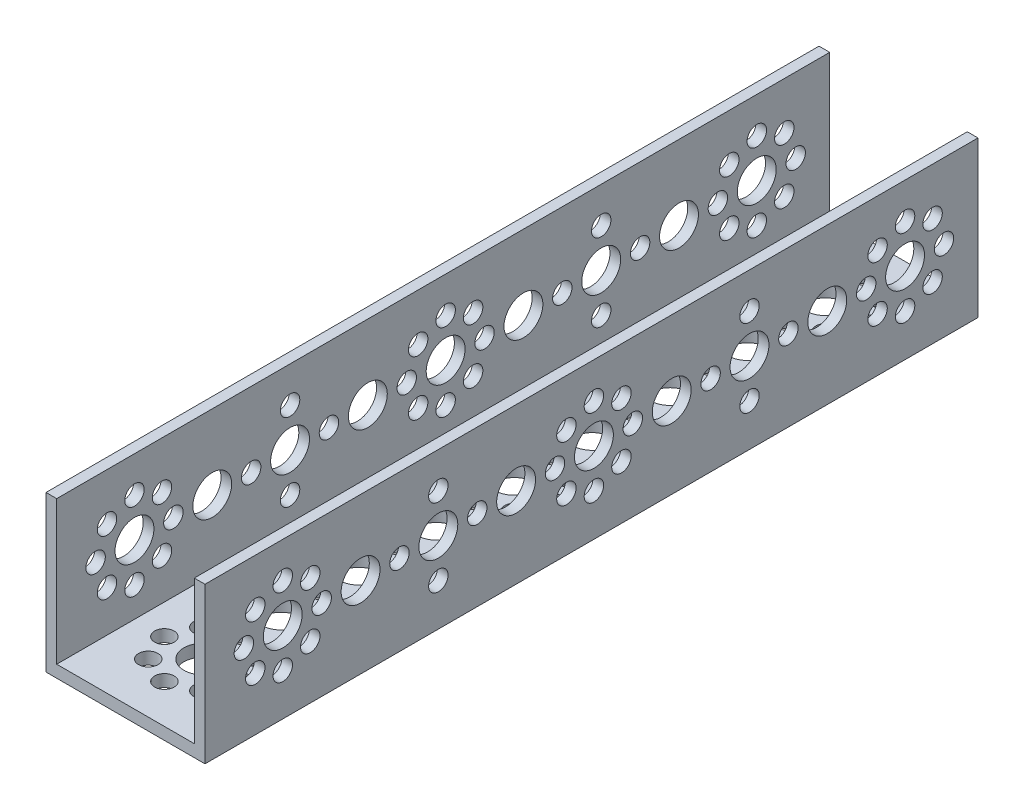
from build123d import *

# Parameters (mm, degrees)
BOSS_EXTRU_1_DEPTH                    = 159
ESQUISSE2_R                           = 4
ENL_V_MAT_EXTRU_1_DEPTH               = 166.451775451
R_P_TITION_LIN_AIRE1_COUNT            = 9
R_P_TITION_LIN_AIRE1_PITCH            = 16
ESQUISSE3_R                           = 2
ENL_V_MAT_EXTRU_2_DEPTH               = 166.451775451
R_P_TITION_CIRCULAIRE1_COUNT          = 4
R_P_TITION_CIRCULAIRE2_COUNT          = 8
R_P_TITION_LIN_AIRE2_COUNT            = 10
R_P_TITION_LIN_AIRE2_PITCH            = 16
R_P_TITION_LIN_AIRE2_COPY_1_SKETCH_R  = 2
R_P_TITION_LIN_AIRE2_COPY_1_DEPTH     = 166.451775451
R_P_TITION_LIN_AIRE2_COPY_2_SKETCH_R  = 2
R_P_TITION_LIN_AIRE2_COPY_2_DEPTH     = 166.451775451
R_P_TITION_LIN_AIRE2_COPY_3_SKETCH_R  = 2
R_P_TITION_LIN_AIRE2_COPY_3_DEPTH     = 166.451775451
R_P_TITION_LIN_AIRE2_COPY_4_SKETCH_R  = 2
R_P_TITION_LIN_AIRE2_COPY_4_DEPTH     = 166.451775451
R_P_TITION_LIN_AIRE2_COPY_5_SKETCH_R  = 2
R_P_TITION_LIN_AIRE2_COPY_5_DEPTH     = 166.451775451
R_P_TITION_LIN_AIRE2_COPY_6_SKETCH_R  = 2
R_P_TITION_LIN_AIRE2_COPY_6_DEPTH     = 166.451775451
R_P_TITION_LIN_AIRE2_COPY_7_SKETCH_R  = 2
R_P_TITION_LIN_AIRE2_COPY_7_DEPTH     = 166.451775451
R_P_TITION_LIN_AIRE2_COPY_8_SKETCH_R  = 2
R_P_TITION_LIN_AIRE2_COPY_8_DEPTH     = 166.451775451
R_P_TITION_LIN_AIRE2_COPY_9_SKETCH_R  = 2
R_P_TITION_LIN_AIRE2_COPY_9_DEPTH     = 166.451775451
R_P_TITION_LIN_AIRE2_COPY_10_SKETCH_R = 2
R_P_TITION_LIN_AIRE2_COPY_10_DEPTH    = 166.451775451
R_P_TITION_LIN_AIRE2_COPY_11_SKETCH_R = 2
R_P_TITION_LIN_AIRE2_COPY_11_DEPTH    = 166.451775451
R_P_TITION_LIN_AIRE2_COPY_12_SKETCH_R = 2
R_P_TITION_LIN_AIRE2_COPY_12_DEPTH    = 166.451775451
R_P_TITION_LIN_AIRE3_COPY_1_SKETCH_R  = 2
R_P_TITION_LIN_AIRE3_COPY_1_DEPTH     = 166.451775451
R_P_TITION_LIN_AIRE3_COPY_2_SKETCH_R  = 2
R_P_TITION_LIN_AIRE3_COPY_2_DEPTH     = 166.451775451
R_P_TITION_LIN_AIRE3_COPY_3_SKETCH_R  = 2
R_P_TITION_LIN_AIRE3_COPY_3_DEPTH     = 166.451775451
R_P_TITION_LIN_AIRE3_COPY_4_SKETCH_R  = 2
R_P_TITION_LIN_AIRE3_COPY_4_DEPTH     = 166.451775451
R_P_TITION_LIN_AIRE3_COPY_5_SKETCH_R  = 2
R_P_TITION_LIN_AIRE3_COPY_5_DEPTH     = 166.451775451
R_P_TITION_LIN_AIRE3_COPY_6_SKETCH_R  = 2
R_P_TITION_LIN_AIRE3_COPY_6_DEPTH     = 166.451775451
R_P_TITION_LIN_AIRE3_COPY_7_SKETCH_R  = 2
R_P_TITION_LIN_AIRE3_COPY_7_DEPTH     = 166.451775451
R_P_TITION_LIN_AIRE3_COPY_8_SKETCH_R  = 2
R_P_TITION_LIN_AIRE3_COPY_8_DEPTH     = 166.451775451
R_P_TITION_LIN_AIRE3_COPY_9_SKETCH_R  = 2
R_P_TITION_LIN_AIRE3_COPY_9_DEPTH     = 166.451775451
R_P_TITION_LIN_AIRE3_COPY_10_SKETCH_R = 2
R_P_TITION_LIN_AIRE3_COPY_10_DEPTH    = 166.451775451
SYM_TRIE2_COPY_1_SKETCH_R             = 4
SYM_TRIE2_COPY_1_DEPTH                = 166.451775451
SYM_TRIE2_COPY_2_SKETCH_R             = 4
SYM_TRIE2_COPY_2_DEPTH                = 166.451775451
SYM_TRIE2_COPY_3_SKETCH_R             = 4
SYM_TRIE2_COPY_3_DEPTH                = 166.451775451
SYM_TRIE2_COPY_4_SKETCH_R             = 4
SYM_TRIE2_COPY_4_DEPTH                = 166.451775451
SYM_TRIE2_COPY_5_SKETCH_R             = 4
SYM_TRIE2_COPY_5_DEPTH                = 166.451775451
SYM_TRIE2_COPY_6_SKETCH_R             = 4
SYM_TRIE2_COPY_6_DEPTH                = 166.451775451
SYM_TRIE2_COPY_7_SKETCH_R             = 4
SYM_TRIE2_COPY_7_DEPTH                = 166.451775451
SYM_TRIE2_COPY_8_SKETCH_R             = 4
SYM_TRIE2_COPY_8_DEPTH                = 166.451775451
SYM_TRIE2_COPY_9_SKETCH_R             = 2
SYM_TRIE2_COPY_9_DEPTH                = 166.451775451
SYM_TRIE2_COPY_10_SKETCH_R            = 2
SYM_TRIE2_COPY_10_DEPTH               = 166.451775451
SYM_TRIE2_COPY_11_SKETCH_R            = 2
SYM_TRIE2_COPY_11_DEPTH               = 166.451775451
SYM_TRIE2_COPY_12_SKETCH_R            = 2
SYM_TRIE2_COPY_12_DEPTH               = 166.451775451
SYM_TRIE2_COPY_13_SKETCH_R            = 2
SYM_TRIE2_COPY_13_DEPTH               = 166.451775451
SYM_TRIE2_COPY_14_SKETCH_R            = 2
SYM_TRIE2_COPY_14_DEPTH               = 166.451775451
SYM_TRIE2_COPY_15_SKETCH_R            = 2
SYM_TRIE2_COPY_15_DEPTH               = 166.451775451
SYM_TRIE2_COPY_16_SKETCH_R            = 2
SYM_TRIE2_COPY_16_DEPTH               = 166.451775451
SYM_TRIE2_COPY_17_SKETCH_R            = 2
SYM_TRIE2_COPY_17_DEPTH               = 166.451775451
SYM_TRIE2_COPY_18_SKETCH_R            = 2
SYM_TRIE2_COPY_18_DEPTH               = 166.451775451
SYM_TRIE2_COPY_19_SKETCH_R            = 2
SYM_TRIE2_COPY_19_DEPTH               = 166.451775451
SYM_TRIE2_COPY_20_SKETCH_R            = 2
SYM_TRIE2_COPY_20_DEPTH               = 166.451775451
SYM_TRIE2_COPY_21_SKETCH_R            = 2
SYM_TRIE2_COPY_21_DEPTH               = 166.451775451
SYM_TRIE2_COPY_22_SKETCH_R            = 2
SYM_TRIE2_COPY_22_DEPTH               = 166.451775451
SYM_TRIE2_COPY_23_SKETCH_R            = 2
SYM_TRIE2_COPY_23_DEPTH               = 166.451775451
SYM_TRIE2_COPY_24_SKETCH_R            = 2
SYM_TRIE2_COPY_24_DEPTH               = 166.451775451
SYM_TRIE2_COPY_25_SKETCH_R            = 2
SYM_TRIE2_COPY_25_DEPTH               = 166.451775451
SYM_TRIE2_COPY_26_SKETCH_R            = 2
SYM_TRIE2_COPY_26_DEPTH               = 166.451775451
SYM_TRIE2_COPY_27_SKETCH_R            = 2
SYM_TRIE2_COPY_27_DEPTH               = 166.451775451
SYM_TRIE2_COPY_28_SKETCH_R            = 2
SYM_TRIE2_COPY_28_DEPTH               = 166.451775451
SYM_TRIE2_COPY_29_SKETCH_R            = 2
SYM_TRIE2_COPY_29_DEPTH               = 166.451775451
SYM_TRIE2_COPY_30_SKETCH_R            = 2
SYM_TRIE2_COPY_30_DEPTH               = 166.451775451
SYM_TRIE2_COPY_31_SKETCH_R            = 2
SYM_TRIE2_COPY_31_DEPTH               = 166.451775451
SYM_TRIE2_COPY_32_SKETCH_R            = 2
SYM_TRIE2_COPY_32_DEPTH               = 166.451775451
SYM_TRIE2_COPY_33_SKETCH_R            = 2
SYM_TRIE2_COPY_33_DEPTH               = 166.451775451
SYM_TRIE2_COPY_34_SKETCH_R            = 2
SYM_TRIE2_COPY_34_DEPTH               = 166.451775451
SYM_TRIE2_COPY_35_SKETCH_R            = 2
SYM_TRIE2_COPY_35_DEPTH               = 166.451775451
SYM_TRIE2_COPY_36_SKETCH_R            = 2
SYM_TRIE2_COPY_36_DEPTH               = 166.451775451
SYM_TRIE2_COPY_37_SKETCH_R            = 2
SYM_TRIE2_COPY_37_DEPTH               = 166.451775451
SYM_TRIE2_COPY_38_SKETCH_R            = 2
SYM_TRIE2_COPY_38_DEPTH               = 166.451775451
SYM_TRIE2_COPY_39_SKETCH_R            = 2
SYM_TRIE2_COPY_39_DEPTH               = 166.451775451
SYM_TRIE2_COPY_40_SKETCH_R            = 2
SYM_TRIE2_COPY_40_DEPTH               = 166.451775451
SYM_TRIE2_COPY_41_SKETCH_R            = 2
SYM_TRIE2_COPY_41_DEPTH               = 166.451775451


with BuildPart() as part:
    # Esquisse1 → Boss.-Extru.1 (new body)
    with BuildSketch(Plane.XY):
        Polygon((0, 0), (0, 32), (2.2, 32), (2.2, 2.5), (30.5, 2.5), (30.5, 32), (32.7, 32), (32.7, 0), align=None)
    extrude(amount=BOSS_EXTRU_1_DEPTH)

    # Esquisse2 → Enlèv. mat.-Extru.1 (cut, symmetric)
    with BuildSketch(Plane(origin=(0, 0, 0), x_dir=(-1, 0, 0), z_dir=(0, -1, 0))):
        with Locations(Location((-16.35, -143, 0), (0, 0, 180))):
            Circle(ESQUISSE2_R)
    enl_v_mat_extru_1 = extrude(amount=ENL_V_MAT_EXTRU_1_DEPTH, both=True, mode=Mode.SUBTRACT)

    # Répétition linéaire1: Enlèv. mat.-Extru.1 ×9
    with Locations(*[(0, 0, -i * R_P_TITION_LIN_AIRE1_PITCH) for i in range(1, R_P_TITION_LIN_AIRE1_COUNT)]):
        add(enl_v_mat_extru_1, mode=Mode.SUBTRACT)

    # Esquisse3 → Enlèv. mat.-Extru.2 (cut, symmetric)
    with BuildSketch(Plane.XZ):
        with Locations((24.35, 143)):
            Circle(ESQUISSE3_R)
    enl_v_mat_extru_2 = extrude(amount=ENL_V_MAT_EXTRU_2_DEPTH, both=True, mode=Mode.SUBTRACT)

    # Répétition circulaire1: Enlèv. mat.-Extru.2 ×4 about axis
    r_p_tition_circulaire1_axis = Axis((16.35, 0, 143), (0, 1, 0))
    for i in range(1, R_P_TITION_CIRCULAIRE1_COUNT):
        add(enl_v_mat_extru_2.rotate(r_p_tition_circulaire1_axis, i * 360 / R_P_TITION_CIRCULAIRE1_COUNT), mode=Mode.SUBTRACT)

    # Répétition circulaire2: Enlèv. mat.-Extru.2 ×8 about axis, 3 skipped
    r_p_tition_circulaire2_axis = Axis((16.35, 0, 143), (0, 1, 0))
    add([enl_v_mat_extru_2.rotate(r_p_tition_circulaire2_axis, i * 360 / R_P_TITION_CIRCULAIRE2_COUNT) for i in range(1, R_P_TITION_CIRCULAIRE2_COUNT) if i not in (2, 4, 6)], mode=Mode.SUBTRACT)

    # Répétition linéaire2: Enlèv. mat.-Extru.2 ×10, 5 skipped
    with Locations(*[(0, 0, -i * R_P_TITION_LIN_AIRE2_PITCH) for i in range(1, R_P_TITION_LIN_AIRE2_COUNT) if i not in (1, 3, 5, 7, 9)]):
        add(enl_v_mat_extru_2, mode=Mode.SUBTRACT)

    # Répétition linéaire2 copy 1 sketch → Répétition linéaire2 copy 1 (cut, symmetric)
    with BuildSketch(Plane(origin=(-126.65, 0, 127.35), x_dir=(0, 0, -1), z_dir=(0, -1, 0))):
        with Locations((24.35, 143)):
            Circle(R_P_TITION_LIN_AIRE2_COPY_1_SKETCH_R)
    extrude(amount=R_P_TITION_LIN_AIRE2_COPY_1_DEPTH, both=True, mode=Mode.SUBTRACT)

    # Répétition linéaire2 copy 2 sketch → Répétition linéaire2 copy 2 (cut, symmetric)
    with BuildSketch(Plane(origin=(-126.65, 0, 95.35), x_dir=(0, 0, -1), z_dir=(0, -1, 0))):
        with Locations((24.35, 143)):
            Circle(R_P_TITION_LIN_AIRE2_COPY_2_SKETCH_R)
    extrude(amount=R_P_TITION_LIN_AIRE2_COPY_2_DEPTH, both=True, mode=Mode.SUBTRACT)

    # Répétition linéaire2 copy 3 sketch → Répétition linéaire2 copy 3 (cut, symmetric)
    with BuildSketch(Plane(origin=(-126.65, 0, 63.35), x_dir=(0, 0, -1), z_dir=(0, -1, 0))):
        with Locations((24.35, 143)):
            Circle(R_P_TITION_LIN_AIRE2_COPY_3_SKETCH_R)
    extrude(amount=R_P_TITION_LIN_AIRE2_COPY_3_DEPTH, both=True, mode=Mode.SUBTRACT)

    # Répétition linéaire2 copy 4 sketch → Répétition linéaire2 copy 4 (cut, symmetric)
    with BuildSketch(Plane(origin=(-126.65, 0, 31.35), x_dir=(0, 0, -1), z_dir=(0, -1, 0))):
        with Locations((24.35, 143)):
            Circle(R_P_TITION_LIN_AIRE2_COPY_4_SKETCH_R)
    extrude(amount=R_P_TITION_LIN_AIRE2_COPY_4_DEPTH, both=True, mode=Mode.SUBTRACT)

    # Répétition linéaire2 copy 5 sketch → Répétition linéaire2 copy 5 (cut, symmetric)
    with BuildSketch(Plane(origin=(32.7, 0, 254), x_dir=(-1, 0, 0), z_dir=(0, -1, 0))):
        with Locations((24.35, 143)):
            Circle(R_P_TITION_LIN_AIRE2_COPY_5_SKETCH_R)
    extrude(amount=R_P_TITION_LIN_AIRE2_COPY_5_DEPTH, both=True, mode=Mode.SUBTRACT)

    # Répétition linéaire2 copy 6 sketch → Répétition linéaire2 copy 6 (cut, symmetric)
    with BuildSketch(Plane(origin=(32.7, 0, 222), x_dir=(-1, 0, 0), z_dir=(0, -1, 0))):
        with Locations((24.35, 143)):
            Circle(R_P_TITION_LIN_AIRE2_COPY_6_SKETCH_R)
    extrude(amount=R_P_TITION_LIN_AIRE2_COPY_6_DEPTH, both=True, mode=Mode.SUBTRACT)

    # Répétition linéaire2 copy 7 sketch → Répétition linéaire2 copy 7 (cut, symmetric)
    with BuildSketch(Plane(origin=(32.7, 0, 190), x_dir=(-1, 0, 0), z_dir=(0, -1, 0))):
        with Locations((24.35, 143)):
            Circle(R_P_TITION_LIN_AIRE2_COPY_7_SKETCH_R)
    extrude(amount=R_P_TITION_LIN_AIRE2_COPY_7_DEPTH, both=True, mode=Mode.SUBTRACT)

    # Répétition linéaire2 copy 8 sketch → Répétition linéaire2 copy 8 (cut, symmetric)
    with BuildSketch(Plane(origin=(32.7, 0, 158), x_dir=(-1, 0, 0), z_dir=(0, -1, 0))):
        with Locations((24.35, 143)):
            Circle(R_P_TITION_LIN_AIRE2_COPY_8_SKETCH_R)
    extrude(amount=R_P_TITION_LIN_AIRE2_COPY_8_DEPTH, both=True, mode=Mode.SUBTRACT)

    # Répétition linéaire2 copy 9 sketch → Répétition linéaire2 copy 9 (cut, symmetric)
    with BuildSketch(Plane(origin=(159.35, 0, 94.65), x_dir=(0, 0, 1), z_dir=(0, -1, 0))):
        with Locations((24.35, 143)):
            Circle(R_P_TITION_LIN_AIRE2_COPY_9_SKETCH_R)
    extrude(amount=R_P_TITION_LIN_AIRE2_COPY_9_DEPTH, both=True, mode=Mode.SUBTRACT)

    # Répétition linéaire2 copy 10 sketch → Répétition linéaire2 copy 10 (cut, symmetric)
    with BuildSketch(Plane(origin=(159.35, 0, 62.65), x_dir=(0, 0, 1), z_dir=(0, -1, 0))):
        with Locations((24.35, 143)):
            Circle(R_P_TITION_LIN_AIRE2_COPY_10_SKETCH_R)
    extrude(amount=R_P_TITION_LIN_AIRE2_COPY_10_DEPTH, both=True, mode=Mode.SUBTRACT)

    # Répétition linéaire2 copy 11 sketch → Répétition linéaire2 copy 11 (cut, symmetric)
    with BuildSketch(Plane(origin=(159.35, 0, 30.65), x_dir=(0, 0, 1), z_dir=(0, -1, 0))):
        with Locations((24.35, 143)):
            Circle(R_P_TITION_LIN_AIRE2_COPY_11_SKETCH_R)
    extrude(amount=R_P_TITION_LIN_AIRE2_COPY_11_DEPTH, both=True, mode=Mode.SUBTRACT)

    # Répétition linéaire2 copy 12 sketch → Répétition linéaire2 copy 12 (cut, symmetric)
    with BuildSketch(Plane(origin=(159.35, 0, -1.35), x_dir=(0, 0, 1), z_dir=(0, -1, 0))):
        with Locations((24.35, 143)):
            Circle(R_P_TITION_LIN_AIRE2_COPY_12_SKETCH_R)
    extrude(amount=R_P_TITION_LIN_AIRE2_COPY_12_DEPTH, both=True, mode=Mode.SUBTRACT)

    # Répétition linéaire3 copy 1 sketch → Répétition linéaire3 copy 1 (cut, symmetric)
    with BuildSketch(Plane(origin=(-96.327465582, 0, -10.555073837), x_dir=(0.7071067811865476, 0, -0.7071067811865475), z_dir=(0, -1, 0))):
        with Locations((24.35, 143)):
            Circle(R_P_TITION_LIN_AIRE3_COPY_1_SKETCH_R)
    extrude(amount=R_P_TITION_LIN_AIRE3_COPY_1_DEPTH, both=True, mode=Mode.SUBTRACT)

    # Répétition linéaire3 copy 2 sketch → Répétition linéaire3 copy 2 (cut, symmetric)
    with BuildSketch(Plane(origin=(-96.327465582, 0, -74.555073837), x_dir=(0.7071067811865476, 0, -0.7071067811865475), z_dir=(0, -1, 0))):
        with Locations((24.35, 143)):
            Circle(R_P_TITION_LIN_AIRE3_COPY_2_SKETCH_R)
    extrude(amount=R_P_TITION_LIN_AIRE3_COPY_2_DEPTH, both=True, mode=Mode.SUBTRACT)

    # Répétition linéaire3 copy 3 sketch → Répétition linéaire3 copy 3 (cut, symmetric)
    with BuildSketch(Plane(origin=(-73.205073837, 0, 191.677465582), x_dir=(-0.7071067811865475, 0, -0.7071067811865476), z_dir=(0, -1, 0))):
        with Locations((24.35, 143)):
            Circle(R_P_TITION_LIN_AIRE3_COPY_3_SKETCH_R)
    extrude(amount=R_P_TITION_LIN_AIRE3_COPY_3_DEPTH, both=True, mode=Mode.SUBTRACT)

    # Répétition linéaire3 copy 4 sketch → Répétition linéaire3 copy 4 (cut, symmetric)
    with BuildSketch(Plane(origin=(-73.205073837, 0, 127.677465582), x_dir=(-0.7071067811865475, 0, -0.7071067811865476), z_dir=(0, -1, 0))):
        with Locations((24.35, 143)):
            Circle(R_P_TITION_LIN_AIRE3_COPY_4_SKETCH_R)
    extrude(amount=R_P_TITION_LIN_AIRE3_COPY_4_DEPTH, both=True, mode=Mode.SUBTRACT)

    # Répétition linéaire3 copy 5 sketch → Répétition linéaire3 copy 5 (cut, symmetric)
    with BuildSketch(Plane(origin=(129.027465582, 0, 168.555073837), x_dir=(-0.7071067811865477, 0, 0.7071067811865475), z_dir=(0, -1, 0))):
        with Locations((24.35, 143)):
            Circle(R_P_TITION_LIN_AIRE3_COPY_5_SKETCH_R)
    extrude(amount=R_P_TITION_LIN_AIRE3_COPY_5_DEPTH, both=True, mode=Mode.SUBTRACT)

    # Répétition linéaire3 copy 6 sketch → Répétition linéaire3 copy 6 (cut, symmetric)
    with BuildSketch(Plane(origin=(129.027465582, 0, 104.555073837), x_dir=(-0.7071067811865477, 0, 0.7071067811865475), z_dir=(0, -1, 0))):
        with Locations((24.35, 143)):
            Circle(R_P_TITION_LIN_AIRE3_COPY_6_SKETCH_R)
    extrude(amount=R_P_TITION_LIN_AIRE3_COPY_6_DEPTH, both=True, mode=Mode.SUBTRACT)

    # Répétition linéaire3 copy 7 sketch → Répétition linéaire3 copy 7 (cut, symmetric)
    with BuildSketch(Plane(origin=(105.905073837, 0, -33.677465582), x_dir=(0.7071067811865474, 0, 0.7071067811865477), z_dir=(0, -1, 0))):
        with Locations((24.35, 143)):
            Circle(R_P_TITION_LIN_AIRE3_COPY_7_SKETCH_R)
    extrude(amount=R_P_TITION_LIN_AIRE3_COPY_7_DEPTH, both=True, mode=Mode.SUBTRACT)

    # Répétition linéaire3 copy 8 sketch → Répétition linéaire3 copy 8 (cut, symmetric)
    with BuildSketch(Plane(origin=(105.905073837, 0, -97.677465582), x_dir=(0.7071067811865474, 0, 0.7071067811865477), z_dir=(0, -1, 0))):
        with Locations((24.35, 143)):
            Circle(R_P_TITION_LIN_AIRE3_COPY_8_SKETCH_R)
    extrude(amount=R_P_TITION_LIN_AIRE3_COPY_8_DEPTH, both=True, mode=Mode.SUBTRACT)

    # Répétition linéaire3 copy 9 sketch → Répétition linéaire3 copy 9 (cut, symmetric)
    with BuildSketch(Plane(origin=(0, 0, -64), x_dir=(1, 0, 0), z_dir=(0, -1, 0))):
        with Locations((24.35, 143)):
            Circle(R_P_TITION_LIN_AIRE3_COPY_9_SKETCH_R)
    extrude(amount=R_P_TITION_LIN_AIRE3_COPY_9_DEPTH, both=True, mode=Mode.SUBTRACT)

    # Répétition linéaire3 copy 10 sketch → Répétition linéaire3 copy 10 (cut, symmetric)
    with BuildSketch(Plane(origin=(0, 0, -128), x_dir=(1, 0, 0), z_dir=(0, -1, 0))):
        with Locations((24.35, 143)):
            Circle(R_P_TITION_LIN_AIRE3_COPY_10_SKETCH_R)
    extrude(amount=R_P_TITION_LIN_AIRE3_COPY_10_DEPTH, both=True, mode=Mode.SUBTRACT)

    # Symétrie2: Enlèv. mat.-Extru.1, Enlèv. mat.-Extru.2 across plane
    add(enl_v_mat_extru_1.mirror(Plane(origin=(-0.15, 0.15, 0), x_dir=(0, 0, 1), z_dir=(0.7071067811865477, -0.7071067811865475, 0))), mode=Mode.SUBTRACT)
    add(enl_v_mat_extru_2.mirror(Plane(origin=(-0.15, 0.15, 0), x_dir=(0, 0, 1), z_dir=(0.7071067811865477, -0.7071067811865475, 0))), mode=Mode.SUBTRACT)

    # Symétrie2 copy 1 sketch → Symétrie2 copy 1 (cut, symmetric)
    with BuildSketch(Plane(origin=(-0.3, 0.3, -16), x_dir=(0, -1, 0), z_dir=(-1, 0, 0))):
        with Locations((-16.35, 143)):
            Circle(SYM_TRIE2_COPY_1_SKETCH_R)
    extrude(amount=SYM_TRIE2_COPY_1_DEPTH, both=True, mode=Mode.SUBTRACT)

    # Symétrie2 copy 2 sketch → Symétrie2 copy 2 (cut, symmetric)
    with BuildSketch(Plane(origin=(-0.3, 0.3, -32), x_dir=(0, -1, 0), z_dir=(-1, 0, 0))):
        with Locations((-16.35, 143)):
            Circle(SYM_TRIE2_COPY_2_SKETCH_R)
    extrude(amount=SYM_TRIE2_COPY_2_DEPTH, both=True, mode=Mode.SUBTRACT)

    # Symétrie2 copy 3 sketch → Symétrie2 copy 3 (cut, symmetric)
    with BuildSketch(Plane(origin=(-0.3, 0.3, -48), x_dir=(0, -1, 0), z_dir=(-1, 0, 0))):
        with Locations((-16.35, 143)):
            Circle(SYM_TRIE2_COPY_3_SKETCH_R)
    extrude(amount=SYM_TRIE2_COPY_3_DEPTH, both=True, mode=Mode.SUBTRACT)

    # Symétrie2 copy 4 sketch → Symétrie2 copy 4 (cut, symmetric)
    with BuildSketch(Plane(origin=(-0.3, 0.3, -64), x_dir=(0, -1, 0), z_dir=(-1, 0, 0))):
        with Locations((-16.35, 143)):
            Circle(SYM_TRIE2_COPY_4_SKETCH_R)
    extrude(amount=SYM_TRIE2_COPY_4_DEPTH, both=True, mode=Mode.SUBTRACT)

    # Symétrie2 copy 5 sketch → Symétrie2 copy 5 (cut, symmetric)
    with BuildSketch(Plane(origin=(-0.3, 0.3, -80), x_dir=(0, -1, 0), z_dir=(-1, 0, 0))):
        with Locations((-16.35, 143)):
            Circle(SYM_TRIE2_COPY_5_SKETCH_R)
    extrude(amount=SYM_TRIE2_COPY_5_DEPTH, both=True, mode=Mode.SUBTRACT)

    # Symétrie2 copy 6 sketch → Symétrie2 copy 6 (cut, symmetric)
    with BuildSketch(Plane(origin=(-0.3, 0.3, -96), x_dir=(0, -1, 0), z_dir=(-1, 0, 0))):
        with Locations((-16.35, 143)):
            Circle(SYM_TRIE2_COPY_6_SKETCH_R)
    extrude(amount=SYM_TRIE2_COPY_6_DEPTH, both=True, mode=Mode.SUBTRACT)

    # Symétrie2 copy 7 sketch → Symétrie2 copy 7 (cut, symmetric)
    with BuildSketch(Plane(origin=(-0.3, 0.3, -112), x_dir=(0, -1, 0), z_dir=(-1, 0, 0))):
        with Locations((-16.35, 143)):
            Circle(SYM_TRIE2_COPY_7_SKETCH_R)
    extrude(amount=SYM_TRIE2_COPY_7_DEPTH, both=True, mode=Mode.SUBTRACT)

    # Symétrie2 copy 8 sketch → Symétrie2 copy 8 (cut, symmetric)
    with BuildSketch(Plane(origin=(-0.3, 0.3, -128), x_dir=(0, -1, 0), z_dir=(-1, 0, 0))):
        with Locations((-16.35, 143)):
            Circle(SYM_TRIE2_COPY_8_SKETCH_R)
    extrude(amount=SYM_TRIE2_COPY_8_DEPTH, both=True, mode=Mode.SUBTRACT)

    # Symétrie2 copy 9 sketch → Symétrie2 copy 9 (cut, symmetric)
    with BuildSketch(Plane(origin=(-0.3, -126.35, 159.35), x_dir=(0, 0, -1), z_dir=(-1, 0, 0))):
        with Locations((24.35, -143)):
            Circle(SYM_TRIE2_COPY_9_SKETCH_R)
    extrude(amount=SYM_TRIE2_COPY_9_DEPTH, both=True, mode=Mode.SUBTRACT)

    # Symétrie2 copy 10 sketch → Symétrie2 copy 10 (cut, symmetric)
    with BuildSketch(Plane(origin=(-0.3, 33, 286), x_dir=(0, -1, 0), z_dir=(-1, 0, 0))):
        with Locations((24.35, -143)):
            Circle(SYM_TRIE2_COPY_10_SKETCH_R)
    extrude(amount=SYM_TRIE2_COPY_10_DEPTH, both=True, mode=Mode.SUBTRACT)

    # Symétrie2 copy 11 sketch → Symétrie2 copy 11 (cut, symmetric)
    with BuildSketch(Plane(origin=(-0.3, 159.65, 126.65), x_dir=(0, 0, 1), z_dir=(-1, 0, 0))):
        with Locations((24.35, -143)):
            Circle(SYM_TRIE2_COPY_11_SKETCH_R)
    extrude(amount=SYM_TRIE2_COPY_11_DEPTH, both=True, mode=Mode.SUBTRACT)

    # Symétrie2 copy 12 sketch → Symétrie2 copy 12 (cut, symmetric)
    with BuildSketch(Plane(origin=(-0.3, -96.027465582, 53.444926163), x_dir=(0, 0.7071067811865477, -0.7071067811865475), z_dir=(-1, 0, 0))):
        with Locations((24.35, -143)):
            Circle(SYM_TRIE2_COPY_12_SKETCH_R)
    extrude(amount=SYM_TRIE2_COPY_12_DEPTH, both=True, mode=Mode.SUBTRACT)

    # Symétrie2 copy 13 sketch → Symétrie2 copy 13 (cut, symmetric)
    with BuildSketch(Plane(origin=(-0.3, -72.905073837, 255.677465582), x_dir=(0, -0.7071067811865476, -0.7071067811865476), z_dir=(-1, 0, 0))):
        with Locations((24.35, -143)):
            Circle(SYM_TRIE2_COPY_13_SKETCH_R)
    extrude(amount=SYM_TRIE2_COPY_13_DEPTH, both=True, mode=Mode.SUBTRACT)

    # Symétrie2 copy 14 sketch → Symétrie2 copy 14 (cut, symmetric)
    with BuildSketch(Plane(origin=(-0.3, 129.327465582, 232.555073837), x_dir=(0, -0.7071067811865478, 0.7071067811865475), z_dir=(-1, 0, 0))):
        with Locations((24.35, -143)):
            Circle(SYM_TRIE2_COPY_14_SKETCH_R)
    extrude(amount=SYM_TRIE2_COPY_14_DEPTH, both=True, mode=Mode.SUBTRACT)

    # Symétrie2 copy 15 sketch → Symétrie2 copy 15 (cut, symmetric)
    with BuildSketch(Plane(origin=(-0.3, 106.205073837, 30.322534418), x_dir=(0, 0.7071067811865475, 0.7071067811865477), z_dir=(-1, 0, 0))):
        with Locations((24.35, -143)):
            Circle(SYM_TRIE2_COPY_15_SKETCH_R)
    extrude(amount=SYM_TRIE2_COPY_15_DEPTH, both=True, mode=Mode.SUBTRACT)

    # Symétrie2 copy 16 sketch → Symétrie2 copy 16 (cut, symmetric)
    with BuildSketch(Plane(origin=(-0.3, 0.3, -32), x_dir=(0, 1, 0), z_dir=(-1, 0, 0))):
        with Locations((24.35, -143)):
            Circle(SYM_TRIE2_COPY_16_SKETCH_R)
    extrude(amount=SYM_TRIE2_COPY_16_DEPTH, both=True, mode=Mode.SUBTRACT)

    # Symétrie2 copy 17 sketch → Symétrie2 copy 17 (cut, symmetric)
    with BuildSketch(Plane(origin=(-0.3, 0.3, -64), x_dir=(0, 1, 0), z_dir=(-1, 0, 0))):
        with Locations((24.35, -143)):
            Circle(SYM_TRIE2_COPY_17_SKETCH_R)
    extrude(amount=SYM_TRIE2_COPY_17_DEPTH, both=True, mode=Mode.SUBTRACT)

    # Symétrie2 copy 18 sketch → Symétrie2 copy 18 (cut, symmetric)
    with BuildSketch(Plane(origin=(-0.3, 0.3, -96), x_dir=(0, 1, 0), z_dir=(-1, 0, 0))):
        with Locations((24.35, -143)):
            Circle(SYM_TRIE2_COPY_18_SKETCH_R)
    extrude(amount=SYM_TRIE2_COPY_18_DEPTH, both=True, mode=Mode.SUBTRACT)

    # Symétrie2 copy 19 sketch → Symétrie2 copy 19 (cut, symmetric)
    with BuildSketch(Plane(origin=(-0.3, 0.3, -128), x_dir=(0, 1, 0), z_dir=(-1, 0, 0))):
        with Locations((24.35, -143)):
            Circle(SYM_TRIE2_COPY_19_SKETCH_R)
    extrude(amount=SYM_TRIE2_COPY_19_DEPTH, both=True, mode=Mode.SUBTRACT)

    # Symétrie2 copy 20 sketch → Symétrie2 copy 20 (cut, symmetric)
    with BuildSketch(Plane(origin=(-0.3, -126.35, 127.35), x_dir=(0, 0, -1), z_dir=(-1, 0, 0))):
        with Locations((24.35, -143)):
            Circle(SYM_TRIE2_COPY_20_SKETCH_R)
    extrude(amount=SYM_TRIE2_COPY_20_DEPTH, both=True, mode=Mode.SUBTRACT)

    # Symétrie2 copy 21 sketch → Symétrie2 copy 21 (cut, symmetric)
    with BuildSketch(Plane(origin=(-0.3, -126.35, 95.35), x_dir=(0, 0, -1), z_dir=(-1, 0, 0))):
        with Locations((24.35, -143)):
            Circle(SYM_TRIE2_COPY_21_SKETCH_R)
    extrude(amount=SYM_TRIE2_COPY_21_DEPTH, both=True, mode=Mode.SUBTRACT)

    # Symétrie2 copy 22 sketch → Symétrie2 copy 22 (cut, symmetric)
    with BuildSketch(Plane(origin=(-0.3, -126.35, 63.35), x_dir=(0, 0, -1), z_dir=(-1, 0, 0))):
        with Locations((24.35, -143)):
            Circle(SYM_TRIE2_COPY_22_SKETCH_R)
    extrude(amount=SYM_TRIE2_COPY_22_DEPTH, both=True, mode=Mode.SUBTRACT)

    # Symétrie2 copy 23 sketch → Symétrie2 copy 23 (cut, symmetric)
    with BuildSketch(Plane(origin=(-0.3, -126.35, 31.35), x_dir=(0, 0, -1), z_dir=(-1, 0, 0))):
        with Locations((24.35, -143)):
            Circle(SYM_TRIE2_COPY_23_SKETCH_R)
    extrude(amount=SYM_TRIE2_COPY_23_DEPTH, both=True, mode=Mode.SUBTRACT)

    # Symétrie2 copy 24 sketch → Symétrie2 copy 24 (cut, symmetric)
    with BuildSketch(Plane(origin=(-0.3, 33, 254), x_dir=(0, -1, 0), z_dir=(-1, 0, 0))):
        with Locations((24.35, -143)):
            Circle(SYM_TRIE2_COPY_24_SKETCH_R)
    extrude(amount=SYM_TRIE2_COPY_24_DEPTH, both=True, mode=Mode.SUBTRACT)

    # Symétrie2 copy 25 sketch → Symétrie2 copy 25 (cut, symmetric)
    with BuildSketch(Plane(origin=(-0.3, 33, 222), x_dir=(0, -1, 0), z_dir=(-1, 0, 0))):
        with Locations((24.35, -143)):
            Circle(SYM_TRIE2_COPY_25_SKETCH_R)
    extrude(amount=SYM_TRIE2_COPY_25_DEPTH, both=True, mode=Mode.SUBTRACT)

    # Symétrie2 copy 26 sketch → Symétrie2 copy 26 (cut, symmetric)
    with BuildSketch(Plane(origin=(-0.3, 33, 190), x_dir=(0, -1, 0), z_dir=(-1, 0, 0))):
        with Locations((24.35, -143)):
            Circle(SYM_TRIE2_COPY_26_SKETCH_R)
    extrude(amount=SYM_TRIE2_COPY_26_DEPTH, both=True, mode=Mode.SUBTRACT)

    # Symétrie2 copy 27 sketch → Symétrie2 copy 27 (cut, symmetric)
    with BuildSketch(Plane(origin=(-0.3, 33, 158), x_dir=(0, -1, 0), z_dir=(-1, 0, 0))):
        with Locations((24.35, -143)):
            Circle(SYM_TRIE2_COPY_27_SKETCH_R)
    extrude(amount=SYM_TRIE2_COPY_27_DEPTH, both=True, mode=Mode.SUBTRACT)

    # Symétrie2 copy 28 sketch → Symétrie2 copy 28 (cut, symmetric)
    with BuildSketch(Plane(origin=(-0.3, 159.65, 94.65), x_dir=(0, 0, 1), z_dir=(-1, 0, 0))):
        with Locations((24.35, -143)):
            Circle(SYM_TRIE2_COPY_28_SKETCH_R)
    extrude(amount=SYM_TRIE2_COPY_28_DEPTH, both=True, mode=Mode.SUBTRACT)

    # Symétrie2 copy 29 sketch → Symétrie2 copy 29 (cut, symmetric)
    with BuildSketch(Plane(origin=(-0.3, 159.65, 62.65), x_dir=(0, 0, 1), z_dir=(-1, 0, 0))):
        with Locations((24.35, -143)):
            Circle(SYM_TRIE2_COPY_29_SKETCH_R)
    extrude(amount=SYM_TRIE2_COPY_29_DEPTH, both=True, mode=Mode.SUBTRACT)

    # Symétrie2 copy 30 sketch → Symétrie2 copy 30 (cut, symmetric)
    with BuildSketch(Plane(origin=(-0.3, 159.65, 30.65), x_dir=(0, 0, 1), z_dir=(-1, 0, 0))):
        with Locations((24.35, -143)):
            Circle(SYM_TRIE2_COPY_30_SKETCH_R)
    extrude(amount=SYM_TRIE2_COPY_30_DEPTH, both=True, mode=Mode.SUBTRACT)

    # Symétrie2 copy 31 sketch → Symétrie2 copy 31 (cut, symmetric)
    with BuildSketch(Plane(origin=(-0.3, 159.65, -1.35), x_dir=(0, 0, 1), z_dir=(-1, 0, 0))):
        with Locations((24.35, -143)):
            Circle(SYM_TRIE2_COPY_31_SKETCH_R)
    extrude(amount=SYM_TRIE2_COPY_31_DEPTH, both=True, mode=Mode.SUBTRACT)

    # Symétrie2 copy 32 sketch → Symétrie2 copy 32 (cut, symmetric)
    with BuildSketch(Plane(origin=(-0.3, -96.027465582, -10.555073837), x_dir=(0, 0.7071067811865477, -0.7071067811865475), z_dir=(-1, 0, 0))):
        with Locations((24.35, -143)):
            Circle(SYM_TRIE2_COPY_32_SKETCH_R)
    extrude(amount=SYM_TRIE2_COPY_32_DEPTH, both=True, mode=Mode.SUBTRACT)

    # Symétrie2 copy 33 sketch → Symétrie2 copy 33 (cut, symmetric)
    with BuildSketch(Plane(origin=(-0.3, -96.027465582, -74.555073837), x_dir=(0, 0.7071067811865477, -0.7071067811865475), z_dir=(-1, 0, 0))):
        with Locations((24.35, -143)):
            Circle(SYM_TRIE2_COPY_33_SKETCH_R)
    extrude(amount=SYM_TRIE2_COPY_33_DEPTH, both=True, mode=Mode.SUBTRACT)

    # Symétrie2 copy 34 sketch → Symétrie2 copy 34 (cut, symmetric)
    with BuildSketch(Plane(origin=(-0.3, -72.905073837, 191.677465582), x_dir=(0, -0.7071067811865476, -0.7071067811865476), z_dir=(-1, 0, 0))):
        with Locations((24.35, -143)):
            Circle(SYM_TRIE2_COPY_34_SKETCH_R)
    extrude(amount=SYM_TRIE2_COPY_34_DEPTH, both=True, mode=Mode.SUBTRACT)

    # Symétrie2 copy 35 sketch → Symétrie2 copy 35 (cut, symmetric)
    with BuildSketch(Plane(origin=(-0.3, -72.905073837, 127.677465582), x_dir=(0, -0.7071067811865476, -0.7071067811865476), z_dir=(-1, 0, 0))):
        with Locations((24.35, -143)):
            Circle(SYM_TRIE2_COPY_35_SKETCH_R)
    extrude(amount=SYM_TRIE2_COPY_35_DEPTH, both=True, mode=Mode.SUBTRACT)

    # Symétrie2 copy 36 sketch → Symétrie2 copy 36 (cut, symmetric)
    with BuildSketch(Plane(origin=(-0.3, 129.327465582, 168.555073837), x_dir=(0, -0.7071067811865478, 0.7071067811865475), z_dir=(-1, 0, 0))):
        with Locations((24.35, -143)):
            Circle(SYM_TRIE2_COPY_36_SKETCH_R)
    extrude(amount=SYM_TRIE2_COPY_36_DEPTH, both=True, mode=Mode.SUBTRACT)

    # Symétrie2 copy 37 sketch → Symétrie2 copy 37 (cut, symmetric)
    with BuildSketch(Plane(origin=(-0.3, 129.327465582, 104.555073837), x_dir=(0, -0.7071067811865478, 0.7071067811865475), z_dir=(-1, 0, 0))):
        with Locations((24.35, -143)):
            Circle(SYM_TRIE2_COPY_37_SKETCH_R)
    extrude(amount=SYM_TRIE2_COPY_37_DEPTH, both=True, mode=Mode.SUBTRACT)

    # Symétrie2 copy 38 sketch → Symétrie2 copy 38 (cut, symmetric)
    with BuildSketch(Plane(origin=(-0.3, 106.205073837, -33.677465582), x_dir=(0, 0.7071067811865475, 0.7071067811865477), z_dir=(-1, 0, 0))):
        with Locations((24.35, -143)):
            Circle(SYM_TRIE2_COPY_38_SKETCH_R)
    extrude(amount=SYM_TRIE2_COPY_38_DEPTH, both=True, mode=Mode.SUBTRACT)

    # Symétrie2 copy 39 sketch → Symétrie2 copy 39 (cut, symmetric)
    with BuildSketch(Plane(origin=(-0.3, 106.205073837, -97.677465582), x_dir=(0, 0.7071067811865475, 0.7071067811865477), z_dir=(-1, 0, 0))):
        with Locations((24.35, -143)):
            Circle(SYM_TRIE2_COPY_39_SKETCH_R)
    extrude(amount=SYM_TRIE2_COPY_39_DEPTH, both=True, mode=Mode.SUBTRACT)

    # Symétrie2 copy 40 sketch → Symétrie2 copy 40 (cut, symmetric)
    with BuildSketch(Plane(origin=(-0.3, 0.3, -64), x_dir=(0, 1, 0), z_dir=(-1, 0, 0))):
        with Locations((24.35, -143)):
            Circle(SYM_TRIE2_COPY_40_SKETCH_R)
    extrude(amount=SYM_TRIE2_COPY_40_DEPTH, both=True, mode=Mode.SUBTRACT)

    # Symétrie2 copy 41 sketch → Symétrie2 copy 41 (cut, symmetric)
    with BuildSketch(Plane(origin=(-0.3, 0.3, -128), x_dir=(0, 1, 0), z_dir=(-1, 0, 0))):
        with Locations((24.35, -143)):
            Circle(SYM_TRIE2_COPY_41_SKETCH_R)
    extrude(amount=SYM_TRIE2_COPY_41_DEPTH, both=True, mode=Mode.SUBTRACT)


solid = part.part
